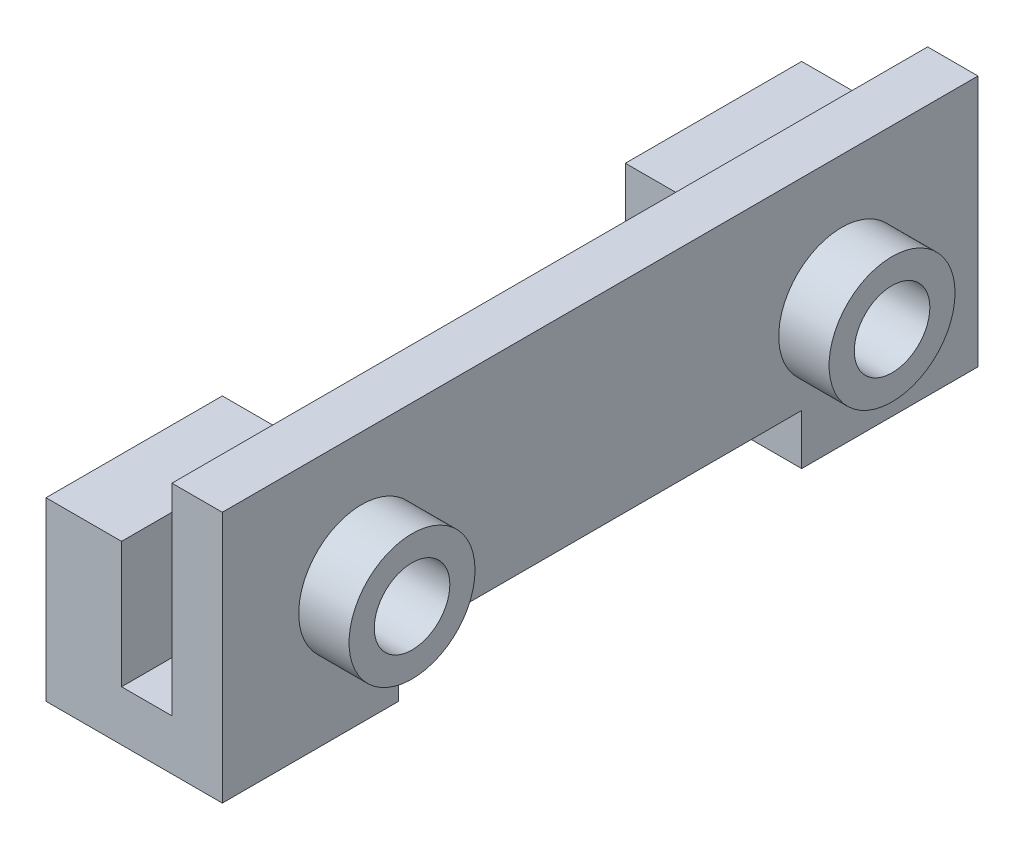
from build123d import *

# Parameters (mm, degrees)
ESQUISSE1_W             = 30
ESQUISSE1_H             = 10
BOSS_EXTRU_1_DEPTH      = 2
ESQUISSE2_R             = 2.5
BOSS_EXTRU_2_DEPTH      = 2
ESQUISSE3_R             = 1.5
ENL_V_MAT_EXTRU_1_DEPTH = 17.30950643
ESQUISSE4_R             = 1.5
ENL_V_MAT_EXTRU_2_DEPTH = 17.30950643
ESQUISSE7_W             = 2
ESQUISSE7_H             = 8
ENL_V_MAT_EXTRU_3_DEPTH = 2
ESQUISSE8_W             = 7
ESQUISSE8_H             = 2
BOSS_EXTRU_3_DEPTH      = 5
ESQUISSE12_W            = 3
ESQUISSE12_H            = 7
BOSS_EXTRU_4_DEPTH      = 5


with BuildPart() as part:
    # Esquisse1 → Boss.-Extru.1 (new body)
    with BuildSketch(Plane(origin=(0, 0, 0), x_dir=(0, 0, -1), z_dir=(1, 0, 0))):
        Rectangle(ESQUISSE1_W, ESQUISSE1_H)
    extrude(amount=BOSS_EXTRU_1_DEPTH)

    # Esquisse2 → Boss.-Extru.2 (add)
    with BuildSketch(Plane(origin=(2, 0, 0), x_dir=(0, 0, -1), z_dir=(1, 0, 0))):
        with Locations((-9.467846224, 0)):
            Circle(ESQUISSE2_R)
        with Locations((9.588622493, 0)):
            Circle(ESQUISSE2_R)
    extrude(amount=BOSS_EXTRU_2_DEPTH)

    # Esquisse3 → Enlèv. mat.-Extru.1 (cut, through all)
    with BuildSketch(Plane(origin=(4, 0, 0), x_dir=(0, 0, -1), z_dir=(1, 0, 0))):
        with Locations((-9.467846224, 0)):
            Circle(ESQUISSE3_R)
    extrude(amount=-ENL_V_MAT_EXTRU_1_DEPTH, mode=Mode.SUBTRACT)

    # Esquisse4 → Enlèv. mat.-Extru.2 (cut, through all)
    with BuildSketch(Plane(origin=(4, 0, 0), x_dir=(0, 0, -1), z_dir=(1, 0, 0))):
        with Locations((9.588622493, 0)):
            Circle(ESQUISSE4_R)
    extrude(amount=-ENL_V_MAT_EXTRU_2_DEPTH, mode=Mode.SUBTRACT)

    # Esquisse7 → Enlèv. mat.-Extru.3 (cut)
    with BuildSketch(Plane.XZ.offset(5)):
        with Locations((1, 4)):
            Rectangle(ESQUISSE7_W, ESQUISSE7_H)
    enl_v_mat_extru_3 = extrude(amount=-ENL_V_MAT_EXTRU_3_DEPTH, mode=Mode.SUBTRACT)

    # Symétrie1: Enlèv. mat.-Extru.3 across plane
    add(enl_v_mat_extru_3.mirror(Plane.XY), mode=Mode.SUBTRACT)

    # Esquisse8 → Boss.-Extru.3 (add)
    with BuildSketch(Plane.ZY):
        with Locations((-11.5, -4)):
            Rectangle(ESQUISSE8_W, ESQUISSE8_H)
    boss_extru_3 = extrude(amount=BOSS_EXTRU_3_DEPTH)

    # Esquisse12 → Boss.-Extru.4 (add)
    with BuildSketch(Plane(origin=(0, -3, 0), x_dir=(1, 0, 0), z_dir=(0, 1, 0))):
        with Locations((-3.5, 11.5)):
            Rectangle(ESQUISSE12_W, ESQUISSE12_H)
    boss_extru_4 = extrude(amount=BOSS_EXTRU_4_DEPTH)

    # Symétrie2: Boss.-Extru.3, Boss.-Extru.4 across plane
    add(boss_extru_3.mirror(Plane.XY))
    add(boss_extru_4.mirror(Plane.XY))


solid = part.part
